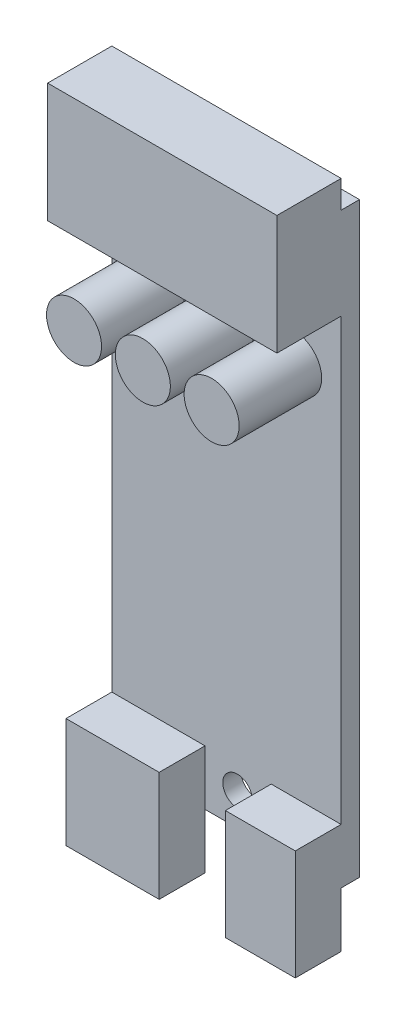
from build123d import *

# Parameters (mm, degrees)
SKETCH1_W                      = 25
SKETCH1_H                      = 67
BOSS_EXTRUDE1_DEPTH            = 9
SKETCH2_W                      = 2
SKETCH2_H                      = 3
CUT_EXTRUDE1_DEPTH             = 73.076348409
SKETCH3_W                      = 7
SKETCH3_H                      = 54
CUT_EXTRUDE2_DEPTH             = 73.076348409
BOSS_EXTRUDE2_DEPTH            = 10.16
BOSS_EXTRUDE3_DEPTH            = 7.62
SKETCH6_W                      = 3
SKETCH6_H                      = 9
SKETCH7_W                      = 3
SKETCH7_H                      = 9
SKETCH8_W                      = 3
SKETCH8_H                      = 9
F_3_2_3_2_DIAMETER_HOLE1_D     = 3.2
F_3_2_3_2_DIAMETER_HOLE1_DEPTH = 11


with BuildPart() as part:
    # Sketch1 → Boss-Extrude1 (new body)
    with BuildSketch(Plane(origin=(0, 0, 0), x_dir=(-1, 0, 0), z_dir=(0, 0, -1))):
        with Locations((-12.5, 33.5)):
            Rectangle(SKETCH1_W, SKETCH1_H)
    extrude(amount=-BOSS_EXTRUDE1_DEPTH)

    # Sketch2 → Cut-Extrude1 (cut, through all)
    with BuildSketch(Plane.ZY):
        with Locations((1, 65.5)):
            Rectangle(SKETCH2_W, SKETCH2_H)
    extrude(amount=-CUT_EXTRUDE1_DEPTH, mode=Mode.SUBTRACT)

    # Sketch3 → Cut-Extrude2 (cut, through all)
    with BuildSketch(Plane.ZY):
        with Locations((5.5, 27)):
            Rectangle(SKETCH3_W, SKETCH3_H)
    extrude(amount=-CUT_EXTRUDE2_DEPTH, mode=Mode.SUBTRACT)

    # Sketch4 → Boss-Extrude2 (add)
    with BuildSketch(Plane(origin=(0, 0, 0), x_dir=(0, -1, 0), z_dir=(-1, 0, 0))):
        Polygon((-6, 2), (0, 2), (6, 2), (6, 7), (-6, 7), align=None)
    extrude(amount=-BOSS_EXTRUDE2_DEPTH)

    # Sketch5 → Boss-Extrude3 (add)
    with BuildSketch(Plane(origin=(25, 0, 0), x_dir=(0, 0, -1), z_dir=(1, 0, 0))):
        Polygon((-2, 0), (-2, 6), (-7, 6), (-7, -6), (-2, -6), align=None)
    extrude(amount=-BOSS_EXTRUDE3_DEPTH)

    # Sketch6 → Revolve1 (revolve)
    with BuildSketch(Plane.XZ.offset(-47.064665705), mode=Mode.PRIVATE) as revolve1_sk:
        with Locations((21.380279303, 6.5)):
            Rectangle(SKETCH6_W, SKETCH6_H)
    revolve(revolve1_sk.sketch.rotate(Axis((19.880279303, 47.064665705, 11), (0, 0, -1)), 180), axis=Axis((19.880279303, 47.064665705, 11), (0, 0, -1)))

    # Sketch7 → Revolve2 (revolve)
    with BuildSketch(Plane.XZ.offset(-47.064665705), mode=Mode.PRIVATE) as revolve2_sk:
        with Locations((13.880279303, 6.5)):
            Rectangle(SKETCH7_W, SKETCH7_H)
    revolve(revolve2_sk.sketch.rotate(Axis((12.380279303, 47.064665705, 11), (0, 0, -1)), 180), axis=Axis((12.380279303, 47.064665705, 11), (0, 0, -1)))

    # Sketch8 → Revolve3 (revolve)
    with BuildSketch(Plane.XZ.offset(-47.064665705), mode=Mode.PRIVATE) as revolve3_sk:
        with Locations((6.380279303, 6.5)):
            Rectangle(SKETCH8_W, SKETCH8_H)
    revolve(revolve3_sk.sketch.rotate(Axis((4.880279303, 47.064665705, 11), (0, 0, -1)), 180), axis=Axis((4.880279303, 47.064665705, 11), (0, 0, -1)))

    # Ø3.2 (3.2) Diameter Hole1
    with Locations(Plane(origin=(0, 0, 0), x_dir=(-1, 0, 0), z_dir=(0, 0, -1))):
        with Locations((-15.2, 40.7), (-13.7, 3.5)):
            Hole(F_3_2_3_2_DIAMETER_HOLE1_D / 2, depth=F_3_2_3_2_DIAMETER_HOLE1_DEPTH)


solid = part.part
